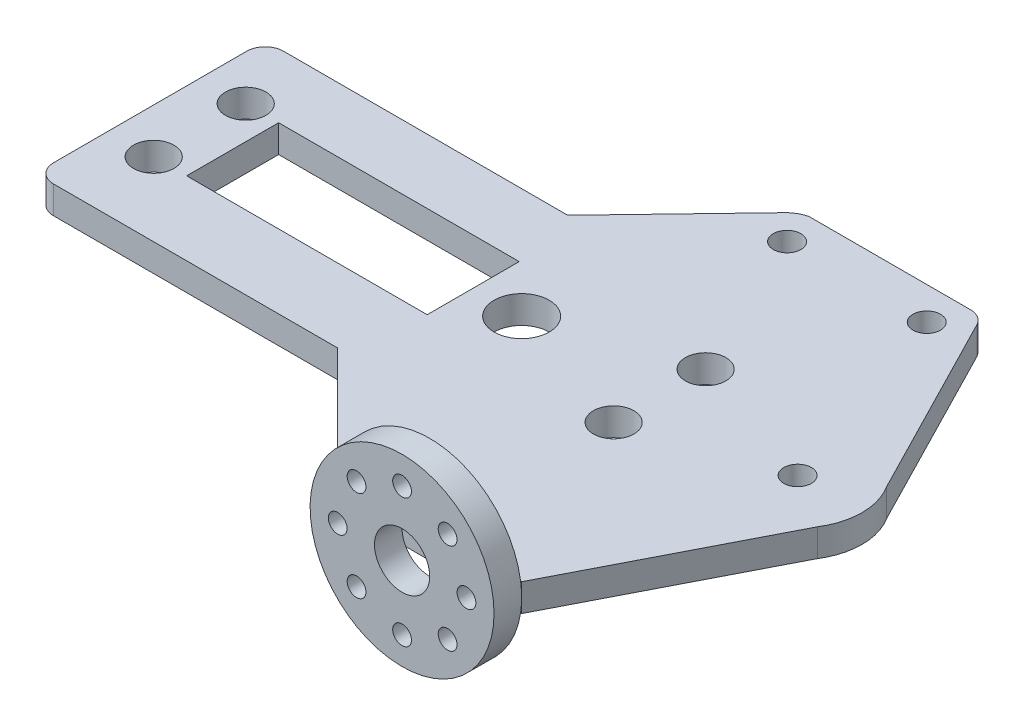
from build123d import *

# Parameters (mm, degrees)
SKETCH_1_R               = 10
SKETCH_1_R_2             = 1.02
SKETCH_1_R_3             = 1.5
EXTRUDE_1_DEPTH          = 3
SKETCH_2_R               = 5
EXTRUDE_2_DEPTH          = 1
CUT_EXTRUDE_1_DEPTH      = 10
CUT_EXTRUDE_1_DEPTH_BACK = 0.5
SKETCH_3_R               = 3
SKETCH_4_R               = 1.5
CUT_EXTRUDE_2_DEPTH      = 8.5
CUT_EXTRUDE_START        = -10
SKETCH_5_R               = 3
CUT_EXTRUDE_3_DEPTH      = 10
EXTRUDE_3_DEPTH          = 50
SKETCH_7_W               = 26.150152834
SKETCH_7_H               = 10
SKETCH_7_R               = 1.5
SKETCH_7_R_2             = 3
SKETCH_7_R_3             = 2.2
CUT_EXTRUDE_8_DEPTH      = 50
SKETCH_9_W               = 3.765706055
SKETCH_9_H               = 11.940159279
CUT_EXTRUDE_9_DEPTH      = 50


with BuildPart() as part:
    # ｽｹｯﾁ1 → ﾎﾞｽ - 押し出し1 (new body)
    with BuildSketch(Plane.XY):
        with Locations((-29.978703949, 66)):
            Circle(SKETCH_1_R)
        with Locations((-25.028956481, 61.050252532)):
            Circle(SKETCH_1_R_2, mode=Mode.SUBTRACT)
        with Locations((-29.978703949, 59)):
            Circle(SKETCH_1_R_2, mode=Mode.SUBTRACT)
        with Locations((-34.928451418, 61.050252532)):
            Circle(SKETCH_1_R_2, mode=Mode.SUBTRACT)
        with Locations((-36.978703949, 66)):
            Circle(SKETCH_1_R_2, mode=Mode.SUBTRACT)
        with Locations((-34.928451418, 70.949747468)):
            Circle(SKETCH_1_R_2, mode=Mode.SUBTRACT)
        with Locations((-29.978703949, 73)):
            Circle(SKETCH_1_R_2, mode=Mode.SUBTRACT)
        with Locations((-25.028956481, 70.949747468)):
            Circle(SKETCH_1_R_2, mode=Mode.SUBTRACT)
        with Locations((-22.978703949, 66)):
            Circle(SKETCH_1_R_2, mode=Mode.SUBTRACT)
        with Locations((-29.978703949, 66)):
            Circle(SKETCH_1_R_3, mode=Mode.SUBTRACT)
    extrude(amount=EXTRUDE_1_DEPTH)

    # ｽｹｯﾁ2 → ﾎﾞｽ - 押し出し2 (add)
    with BuildSketch(Plane.XY.offset(3)):
        with Locations((-29.978703949, 66)):
            Circle(SKETCH_2_R)
    extrude(amount=EXTRUDE_2_DEPTH)

    # ｽｹｯﾁ3 → ｶｯﾄ - 押し出し1 (cut, two sides: drawn at the far end of the back side and taken through both)
    with BuildSketch(Plane(origin=(0, 0, 3), x_dir=(-1, 0, 0), z_dir=(0, 0, -1)).offset(-CUT_EXTRUDE_1_DEPTH_BACK)):
        with Locations(Location((29.978703949, 66, 0), (0, 0, 180))):
            Circle(SKETCH_3_R)
    extrude(amount=CUT_EXTRUDE_1_DEPTH + CUT_EXTRUDE_1_DEPTH_BACK, mode=Mode.SUBTRACT)

    # ｽｹｯﾁ4 → ｶｯﾄ - 押し出し2 (cut)
    with BuildSketch(Plane(origin=(0, 0, 3.5), x_dir=(-1, 0, 0), z_dir=(0, 0, -1))):
        with Locations((29.978703949, 66)):
            Circle(SKETCH_4_R)
    extrude(amount=-CUT_EXTRUDE_2_DEPTH, mode=Mode.SUBTRACT)

    # ｽｹｯﾁ5 → ｶｯﾄ - 押し出し3 (cut)
    with BuildSketch(Plane(origin=(0, 0, 0), x_dir=(-1, 0, 0), z_dir=(0, 0, -1)).offset(CUT_EXTRUDE_START)):
        with Locations(Location((29.978703949, 66, 0), (0, 0, 180))):
            Circle(SKETCH_5_R)
    extrude(amount=CUT_EXTRUDE_3_DEPTH, mode=Mode.SUBTRACT)

    # ｽｹｯﾁ6 → ﾎﾞｽ - 押し出し3 (add)
    with BuildSketch(Plane(origin=(0, 0, 0), x_dir=(-1, 0, 0), z_dir=(0, 0, -1))):
        Polygon((29.978703949, 64.5), (89.978703949, 64.5), (89.978703949, 67.5), (29.978703949, 67.5), (7.978703949, 67.5), (7.978703949, 64.5), align=None)
    extrude(amount=EXTRUDE_3_DEPTH)

    # ｽｹｯﾁ7 → ｶｯﾄ - 押し出し8 (cut)
    with BuildSketch(Plane(origin=(0, 67.5, 0), x_dir=(1, 0, 0), z_dir=(0, 1, 0))):
        with BuildLine():
            Line((-100.145182103, -3.51175574), (-39.985484803, 0))
            Line((-39.985484803, 0), (-51.974034344, 12))
            Line((-51.974034344, 12), (-82.864348742, 12))
            ThreePointArc((-82.864348742, 12), (-84.278562304, 12.585786438), (-84.864348742, 14))
            Line((-84.864348742, 14), (-84.864348742, 35))
            ThreePointArc((-84.864348742, 35), (-84.278562304, 36.414213562), (-82.864348742, 37))
            Line((-82.864348742, 37), (-51.974034344, 37))
            Line((-51.974034344, 37), (-40.543200867, 48.912989303))
            ThreePointArc((-40.543200867, 48.912989303), (-39.734398684, 49.588968373), (-38.763748554, 50))
            Line((-38.763748554, 50), (-38.44069987, 54.873631325))
            Line((-38.44069987, 54.873631325), (-103.044452856, 56.708369205))
            Line((-103.044452856, 56.708369205), (-100.145182103, -3.51175574))
        make_face()
        with BuildLine():
            Line((-19.971923095, 56.200079543), (-21.193659345, 50))
            ThreePointArc((-21.193659345, 50), (-20.151061293, 49.706748166), (-19.414207032, 48.912989303))
            Line((-19.414207032, 48.912989303), (-9.074178765, 28.759864671))
            ThreePointArc((-9.074178765, 28.759864671), (-7.978703949, 25), (-9.074178765, 21.240135329))
            Line((-9.074178765, 21.240135329), (-19.971923095, 0))
            Line((-19.971923095, 0), (8.860799546, -5.1085516))
            Line((8.860799546, -5.1085516), (11.142393262, 56.200079543))
            Line((11.142393262, 56.200079543), (-19.971923095, 56.200079543))
        make_face()
        with Locations((-63.322025342, 25)):
            Rectangle(SKETCH_7_W, SKETCH_7_H)
        with Locations(Location((-14.978703949, 25, 0), (0, 0, 270))):
            Circle(SKETCH_7_R)
        with Locations(Location((-22.387170595, 46.444557629, 0), (0, 0, 270))):
            Circle(SKETCH_7_R)
        with Locations(Location((-37.570237303, 46.444557629, 0), (0, 0, 270))):
            Circle(SKETCH_7_R)
        with Locations(Location((-44.978703949, 25, 0), (0, 0, 270))):
            Circle(SKETCH_7_R_2)
        with Locations(Location((-79.978703949, 30, 0), (0, 0, 270))):
            Circle(SKETCH_7_R_3)
        with Locations(Location((-79.978703949, 20, 0), (0, 0, 270))):
            Circle(SKETCH_7_R_3)
        with Locations(Location((-29.978703949, 30, 0), (0, 0, 270))):
            Circle(SKETCH_7_R_3)
        with Locations(Location((-29.978703949, 20, 0), (0, 0, 270))):
            Circle(SKETCH_7_R_3)
    extrude(amount=-CUT_EXTRUDE_8_DEPTH, mode=Mode.SUBTRACT)

    # ｽｹｯﾁ9 → ｶｯﾄ - 押し出し9 (cut)
    with BuildSketch(Plane(origin=(0, 0, 0), x_dir=(0, 0, -1), z_dir=(1, 0, 0))):
        with Locations((-4.882853028, 66.970079639)):
            Rectangle(SKETCH_9_W, SKETCH_9_H)
    extrude(amount=-CUT_EXTRUDE_9_DEPTH, mode=Mode.SUBTRACT)


solid = part.part
